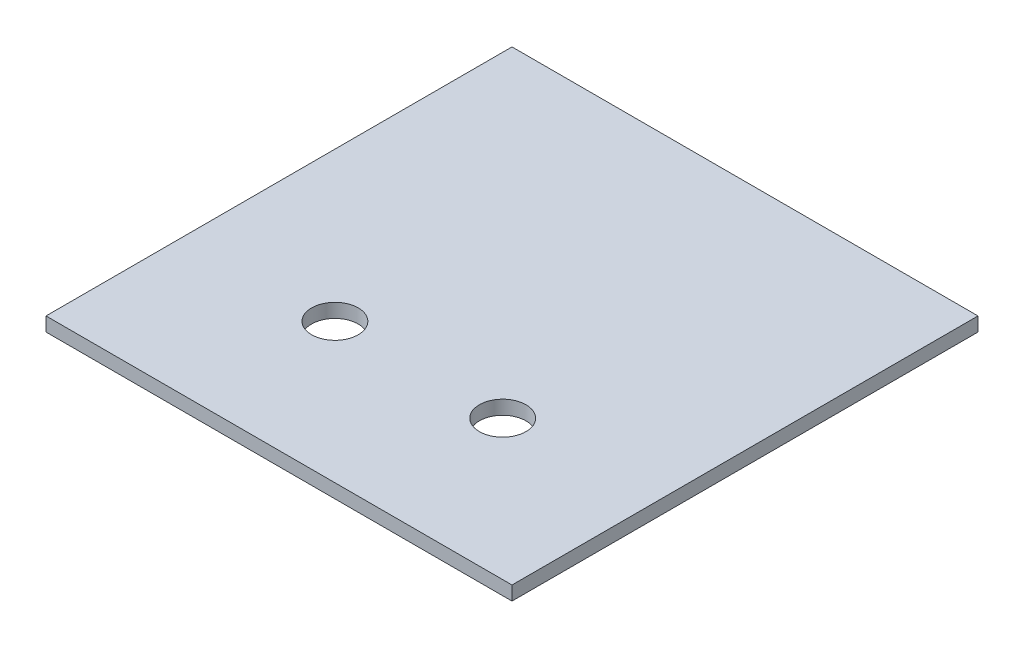
from build123d import *

# Parameters (mm, degrees)
SKETCH_1_W          = 50
SKETCH_1_H          = 50
EXTRUDE_1_DEPTH     = 1.5
SKETCH_2_R          = 2.5
CUT_EXTRUDE_1_DEPTH = 36.387144558


with BuildPart() as part:
    # 草图1 → 凸台-拉伸1 (new body)
    with BuildSketch(Plane(origin=(0, 0, 0), x_dir=(1, 0, 0), z_dir=(0, 1, 0))):
        Rectangle(SKETCH_1_W, SKETCH_1_H)
    extrude(amount=EXTRUDE_1_DEPTH)

    # 草图2 → 切除-拉伸1 (cut, through all)
    with BuildSketch(Plane(origin=(0, 1.5, 0), x_dir=(1, 0, 0), z_dir=(0, 1, 0))):
        with Locations(Location((9, -10, 0), (0, 0, 270))):
            Circle(SKETCH_2_R)
    cut_extrude_1 = extrude(amount=-CUT_EXTRUDE_1_DEPTH, mode=Mode.SUBTRACT)

    # 镜向1: 切除-拉伸1 across plane
    add(cut_extrude_1.mirror(Plane(origin=(0, 0, 0), x_dir=(0, 0, 1), z_dir=(1, 0, 0))), mode=Mode.SUBTRACT)


solid = part.part
